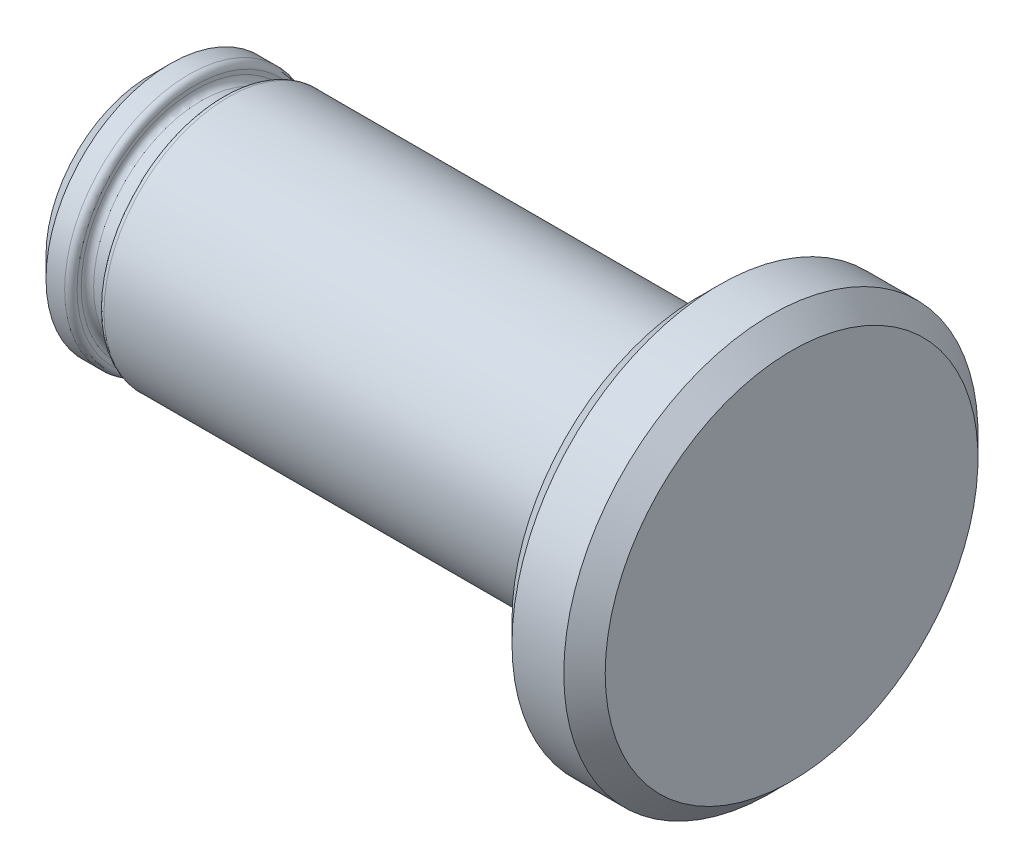
from build123d import *


with BuildPart() as part:
    # Sketch1 → Revolve1 (revolve)
    with BuildSketch(Plane(origin=(0, 0, 0), x_dir=(-1, 0, 0), z_dir=(0, 1, 0))):
        with BuildLine():
            Line((-1, 10), (-3.5, 10))
            Line((-3.5, 10), (-4.5, 9))
            Line((-4.5, 9), (-4.5, 0))
            Line((-4.5, 0), (26.5, 0))
            Line((26.5, 0), (26.5, 5))
            Line((26.5, 5), (25.5, 6))
            Line((25.5, 6), (24.6, 6))
            ThreePointArc((24.6, 6), (24.387867966, 5.912132034), (24.3, 5.7))
            Line((24.3, 5.7), (24.3, 5.5))
            ThreePointArc((24.3, 5.5), (24.212132034, 5.287867966), (24, 5.2))
            Line((24, 5.2), (23.3, 5.2))
            ThreePointArc((23.3, 5.2), (23.087867966, 5.287867966), (23, 5.5))
            Line((23, 5.5), (23, 5.7))
            ThreePointArc((23, 5.7), (22.912132034, 5.912132034), (22.7, 6))
            Line((22.7, 6), (2, 6))
            ThreePointArc((2, 6), (0.585786438, 6.585786438), (0, 8))
            Line((0, 8), (0, 9))
            Line((0, 9), (-1, 10))
        make_face()
    revolve(axis=Axis((-26.5, 0, 0), (1, 0, 0)))


solid = part.part
